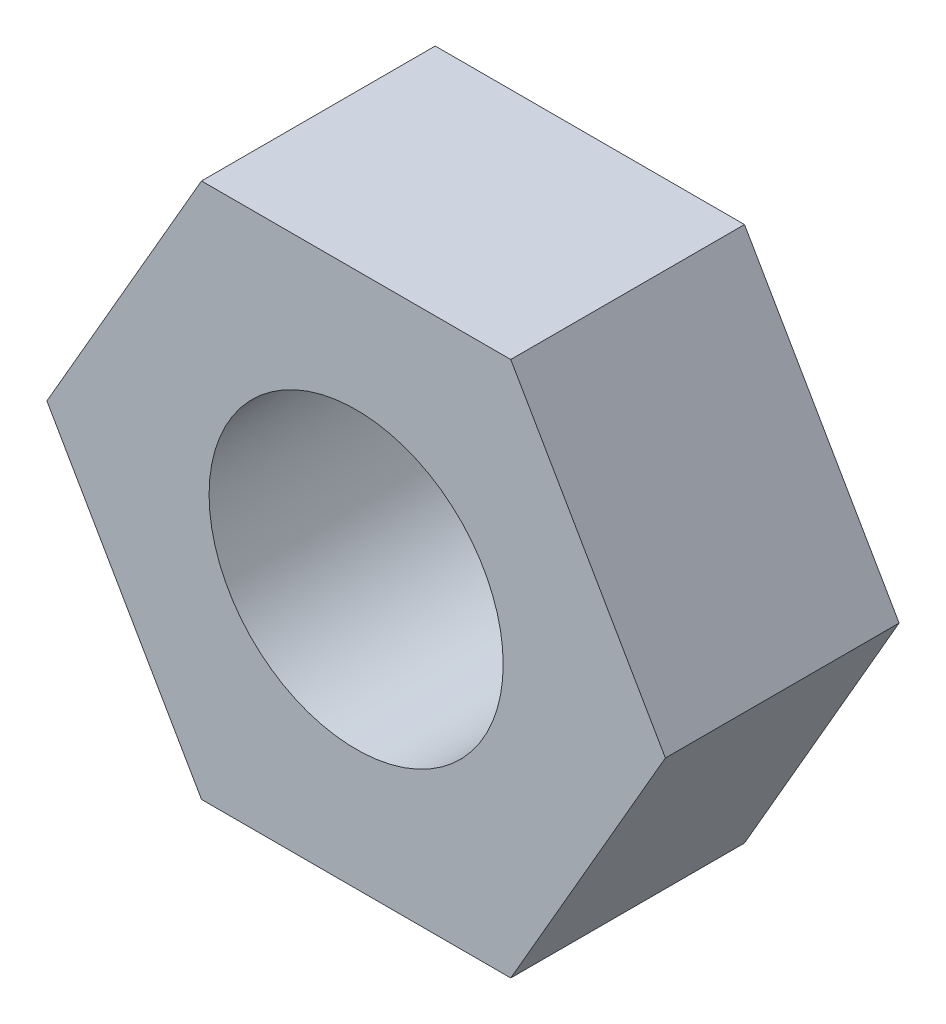
from build123d import *

# Parameters (mm, degrees)
ISO4032_M3_AF5P5_H2P4_SKETCH_R = 1.51
ISO4032_M3_AF5P5_H2P4_DEPTH    = 2.4


with BuildPart() as part:
    # ISO4032_M3_AF5p5_h2p4_Sketch → ISO4032_M3_AF5p5_h2p4 (new body)
    with BuildSketch(Plane.XY):
        Polygon((3.175426481, 0), (1.58771324, 2.75), (-1.58771324, 2.75), (-3.175426481, 0), (-1.58771324, -2.75), (1.58771324, -2.75), align=None)
        Circle(ISO4032_M3_AF5P5_H2P4_SKETCH_R, mode=Mode.SUBTRACT)
    extrude(amount=ISO4032_M3_AF5P5_H2P4_DEPTH)


solid = part.part
